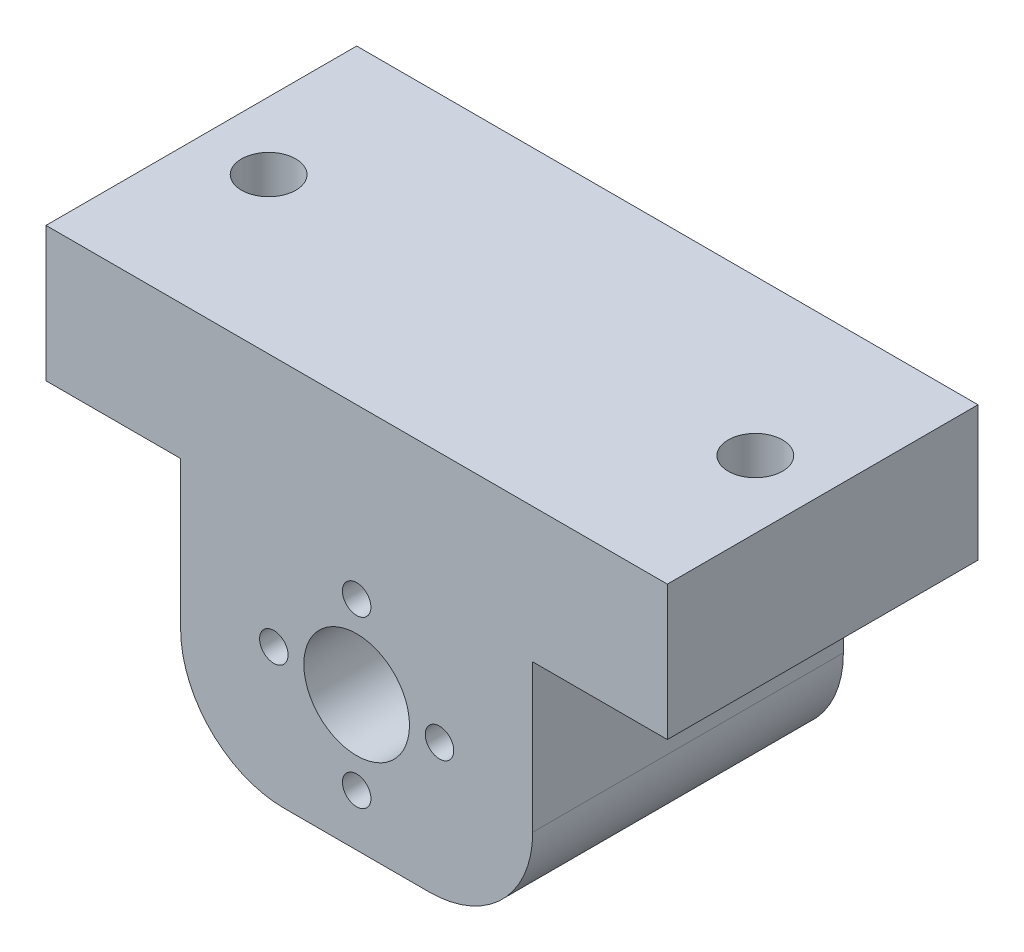
from build123d import *

# Parameters (mm, degrees)
CROQUIS1_R              = 5.1
CROQUIS1_R_2            = 1.375
SALIENTE_EXTRUIR1_DEPTH = 30
CROQUIS2_R              = 11.75
CORTAR_EXTRUIR1_DEPTH   = 5
CROQUIS3_R              = 2.625
CORTAR_EXTRUIR2_DEPTH   = 49.867806376


with BuildPart() as part:
    # Croquis1 → Saliente-Extruir1 (new body)
    with BuildSketch(Plane.XY):
        with BuildLine():
            Line((-30, 24.25), (30, 24.25))
            Line((30, 24.25), (30, 11.25))
            Line((30, 11.25), (17, 11.25))
            Line((17, 11.25), (17, -3))
            ThreePointArc((17, -3), (14.071067812, -10.071067812), (7, -13))
            Line((7, -13), (-7, -13))
            ThreePointArc((-7, -13), (-14.071067812, -10.071067812), (-17, -3))
            Line((-17, -3), (-17, 11.25))
            Line((-17, 11.25), (-30, 11.25))
            Line((-30, 11.25), (-30, 24.25))
        make_face()
        Circle(CROQUIS1_R, mode=Mode.SUBTRACT)
        with Locations((0, 8)):
            Circle(CROQUIS1_R_2, mode=Mode.SUBTRACT)
        with Locations((8, 0)):
            Circle(CROQUIS1_R_2, mode=Mode.SUBTRACT)
        with Locations((0, -8)):
            Circle(CROQUIS1_R_2, mode=Mode.SUBTRACT)
        with Locations((-8, 0)):
            Circle(CROQUIS1_R_2, mode=Mode.SUBTRACT)
    extrude(amount=SALIENTE_EXTRUIR1_DEPTH)

    # Croquis2 → Cortar-Extruir1 (cut)
    with BuildSketch(Plane(origin=(0, 0, 0), x_dir=(-1, 0, 0), z_dir=(0, 0, -1))):
        Circle(CROQUIS2_R)
    extrude(amount=-CORTAR_EXTRUIR1_DEPTH, mode=Mode.SUBTRACT)

    # Croquis3 → Cortar-Extruir2 (cut, through all)
    with BuildSketch(Plane.XZ.offset(-11.25)):
        with Locations(Location((-23.5, 15, 0), (0, 0, 270))):
            Circle(CROQUIS3_R)
        with Locations(Location((23.5, 15, 0), (0, 0, 270))):
            Circle(CROQUIS3_R)
    extrude(amount=-CORTAR_EXTRUIR2_DEPTH, mode=Mode.SUBTRACT)


solid = part.part
